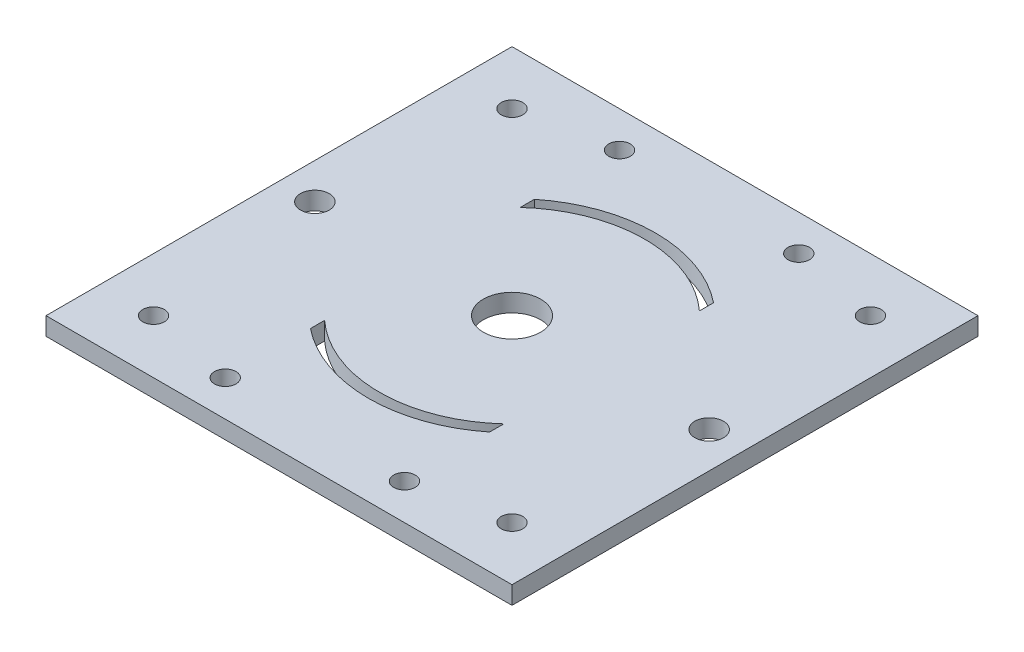
from build123d import *

# Parameters (mm, degrees)
SKETCH1_W           = 130
SKETCH1_H           = 130
SKETCH1_R           = 3
BOSS_EXTRUDE1_DEPTH = 5
SKETCH2_R           = 8
CUT_EXTRUDE1_DEPTH  = 5
SKETCH3_R           = 4
CUT_EXTRUDE2_DEPTH  = 5
SKETCH4_R           = 3
CUT_EXTRUDE3_DEPTH  = 10
CUT_EXTRUDE4_DEPTH  = 10


with BuildPart() as part:
    # Sketch1 → Boss-Extrude1 (new body)
    with BuildSketch(Plane(origin=(0, 0, 0), x_dir=(1, 0, 0), z_dir=(0, 1, 0))):
        Rectangle(SKETCH1_W, SKETCH1_H)
        with Locations(Location((-50, 50, 0), (0, 0, 270))):
            Circle(SKETCH1_R, mode=Mode.SUBTRACT)
        with Locations(Location((50, 50, 0), (0, 0, 90))):
            Circle(SKETCH1_R, mode=Mode.SUBTRACT)
        with Locations(Location((50, -50, 0), (0, 0, 270))):
            Circle(SKETCH1_R, mode=Mode.SUBTRACT)
        with Locations(Location((-50, -50, 0), (0, 0, 90))):
            Circle(SKETCH1_R, mode=Mode.SUBTRACT)
    extrude(amount=BOSS_EXTRUDE1_DEPTH)

    # Sketch2 → Cut-Extrude1 (cut)
    with BuildSketch(Plane(origin=(0, 5, 0), x_dir=(1, 0, 0), z_dir=(0, 1, 0))):
        with Locations(Location((0, 0, 0), (0, 0, 270))):
            Circle(SKETCH2_R)
    extrude(amount=-CUT_EXTRUDE1_DEPTH, mode=Mode.SUBTRACT)

    # Sketch3 → Cut-Extrude2 (cut)
    with BuildSketch(Plane(origin=(0, 5, 0), x_dir=(1, 0, 0), z_dir=(0, 1, 0))):
        with Locations(Location((-55, 0, 0), (0, 0, 270))):
            Circle(SKETCH3_R)
        with Locations(Location((55, 0, 0), (0, 0, 270))):
            Circle(SKETCH3_R)
    extrude(amount=-CUT_EXTRUDE2_DEPTH, mode=Mode.SUBTRACT)

    # Sketch4 → Cut-Extrude3 (cut)
    with BuildSketch(Plane(origin=(0, 5, 0), x_dir=(1, 0, 0), z_dir=(0, 1, 0))):
        with Locations(Location((-25, 55, 0), (0, 0, 270))):
            Circle(SKETCH4_R)
        with Locations(Location((25, 55, 0), (0, 0, 270))):
            Circle(SKETCH4_R)
        with Locations(Location((-25, -55, 0), (0, 0, 270))):
            Circle(SKETCH4_R)
        with Locations(Location((25, -55, 0), (0, 0, 270))):
            Circle(SKETCH4_R)
    extrude(amount=-CUT_EXTRUDE3_DEPTH, mode=Mode.SUBTRACT)

    # Sketch5 → Cut-Extrude4 (cut)
    with BuildSketch(Plane(origin=(0, 5, 0), x_dir=(1, 0, 0), z_dir=(0, 1, 0))):
        with BuildLine():
            Line((25, 31.224989992), (25, 27.276363394))
            ThreePointArc((25, 27.276363394), (0, 37), (-25, 27.276363394))
            Line((-25, 27.276363394), (-25, 31.224989992))
            ThreePointArc((-25, 31.224989992), (0, 40), (25, 31.224989992))
        make_face()
        with BuildLine():
            Line((25, -27.276363394), (25, -31.224989992))
            ThreePointArc((25, -31.224989992), (0, -40), (-25, -31.224989992))
            Line((-25, -31.224989992), (-25, -27.276363394))
            ThreePointArc((-25, -27.276363394), (0, -37), (25, -27.276363394))
        make_face()
    extrude(amount=-CUT_EXTRUDE4_DEPTH, mode=Mode.SUBTRACT)


solid = part.part
